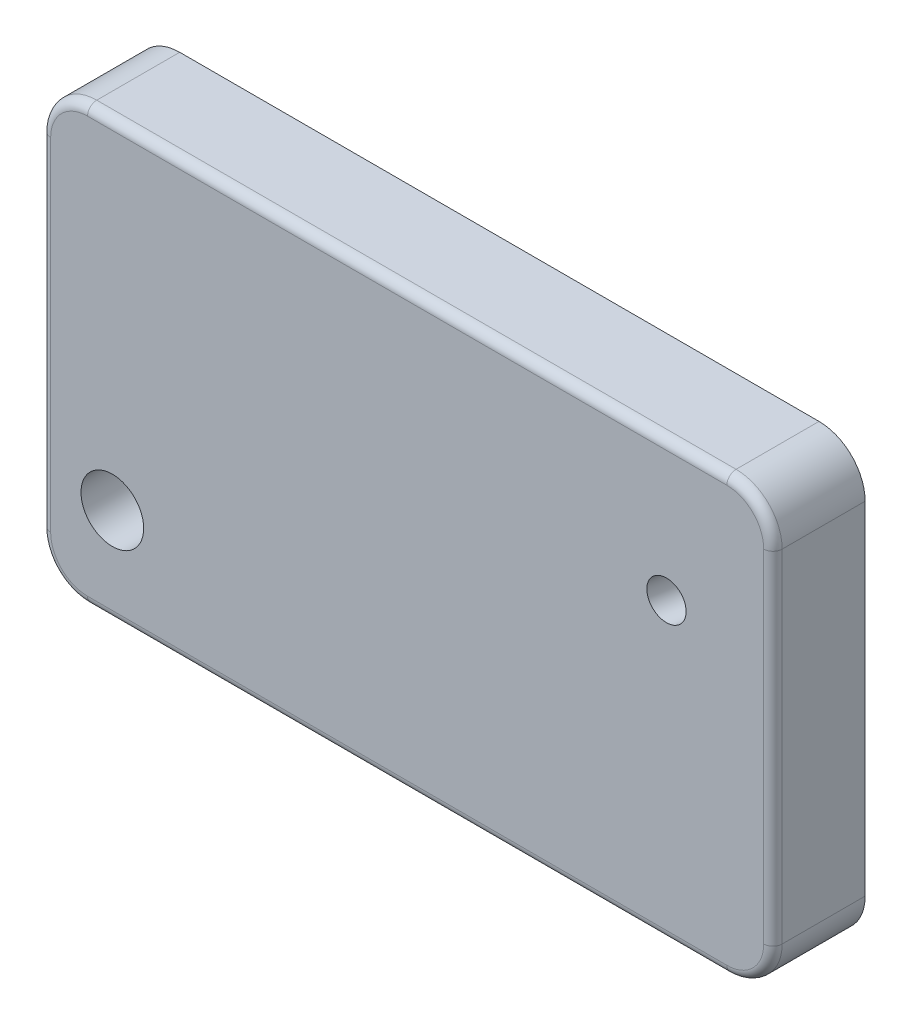
from build123d import *

# Parameters (mm, degrees)
SKETCH1_W           = 43.699940619
SKETCH1_H           = 33.102984907
BOSS_EXTRUDE1_DEPTH = 10
BOSS_EXTRUDE2_DEPTH = 10
M3_TAPPED_HOLE1_D   = 4.2
SKETCH15_W          = 10
SKETCH15_H          = 17.102984907
SKETCH15_W_2        = 13
SKETCH15_H_2        = 47.102984907
CUT_EXTRUDE1_DEPTH  = 10
SKETCH18_W          = 58.662437665
SKETCH18_H          = 17.102984907
BOSS_EXTRUDE4_DEPTH = 10
BOSS_EXTRUDE5_DEPTH = 20
M8_TAPPED_HOLE2_D   = 6.8
FILLET1_R           = 5
FILLET2_R           = 1


with BuildPart() as part:
    # Sketch1 → Boss-Extrude1 (new body)
    with BuildSketch(Plane.XY):
        Polygon((42.979890311, 22.079670103), (-49.382487973, 22.079670103), (-49.382487973, -7.920329897), (-5.682547354, -7.920329897), (42.979890311, -7.920329897), align=None)
        with Locations((-27.532517664, -24.471822351)):
            Rectangle(SKETCH1_W, SKETCH1_H)
    extrude(amount=BOSS_EXTRUDE1_DEPTH)

    # Sketch10 → Boss-Extrude2 (add, symmetric)
    with BuildSketch(Plane(origin=(0, 7.079670103, 0), x_dir=(-1, 0, 0), z_dir=(0, -1, 0))):
        Polygon((-41.673127971, 0), (-24.707127971, 0), (-24.707127971, 2.991563555), align=None)
    extrude(amount=BOSS_EXTRUDE2_DEPTH, both=True)

    # M3 Tapped Hole1 (through all)
    with Locations(Plane(origin=(33.44592172, 6.992687386, -1.450678438), x_dir=(-0.984807753012, 0, -0.173648177667), z_dir=(0.173648177667, 0, -0.984807753012))):
        with Locations((0, 0)):
            Hole(M3_TAPPED_HOLE1_D / 2)

    # Sketch15 → Cut-Extrude1 (cut)
    with BuildSketch(Plane(origin=(0, 0, 0), x_dir=(-1, 0, 0), z_dir=(0, 0, -1))):
        Polygon((5.682547354, -25.023314804), (5.682547354, -41.023314804), (49.382487973, -41.023314804), (49.382487973, -25.023314804), (36.382487973, -25.023314804), (15.682547354, -25.023314804), align=None)
        with Locations((10.682547354, -16.471822351)):
            Rectangle(SKETCH15_W, SKETCH15_H)
        with Locations((42.882487973, -1.471822351)):
            Rectangle(SKETCH15_W_2, SKETCH15_H_2)
    extrude(amount=-CUT_EXTRUDE1_DEPTH, mode=Mode.SUBTRACT)

    # Sketch18 → Boss-Extrude4 (add)
    with BuildSketch(Plane(origin=(0, 0, 0), x_dir=(-1, 0, 0), z_dir=(0, 0, -1))):
        with Locations((-13.648671479, -16.471822351)):
            Rectangle(SKETCH18_W, SKETCH18_H)
    extrude(amount=-BOSS_EXTRUDE4_DEPTH)

    # Sketch19 → Boss-Extrude5 (add)
    with BuildSketch(Plane(origin=(0, 0, 0), x_dir=(-1, 0, 0), z_dir=(0, 0, -1))):
        with BuildLine():
            Line((36.382487973, -25.023314804), (15.730487973, -25.023314804))
            ThreePointArc((15.730487973, -25.023314804), (12.194954067, -23.55884871), (10.730487973, -20.023314804))
            Line((10.730487973, -20.023314804), (10.730487973, -4.371314804))
            ThreePointArc((10.730487973, -4.371314804), (12.194954067, -0.835780898), (15.730487973, 0.628685196))
            Line((15.730487973, 0.628685196), (31.382487973, 0.628685196))
            ThreePointArc((31.382487973, 0.628685196), (34.918021878, -0.835780898), (36.382487973, -4.371314804))
            Line((36.382487973, -4.371314804), (36.382487973, -25.023314804))
        make_face()
    extrude(amount=BOSS_EXTRUDE5_DEPTH)

    # M8 Tapped Hole2 (through all)
    with Locations(Plane(origin=(-28.692487973, -14.610329897, 10), x_dir=(1, 0, 0), z_dir=(0, 0, 1))):
        with Locations((0, 0)):
            Hole(M8_TAPPED_HOLE2_D / 2)

    # Fillet1
    fillet1_edges = [part.edges().sort_by_distance(p)[0] for p in [
        (-36.382487973, -25.023314804, -5),
        (-36.382487973, 22.079670103, 5),
        (42.979890311, -25.023314804, 5),
        (42.979890311, 22.079670103, 5),
    ]]
    fillet(fillet1_edges, radius=FILLET1_R)

    # Fillet2
    fillet2_edges = [part.edges().sort_by_distance(p)[0] for p in [
        (-36.382487973, -1.471822351, 10),
        (3.298701169, 22.079670103, 10),
        (3.298701169, -25.023314804, 10),
        (42.979890311, -1.471822351, 10),
        (-34.918021878, -23.55884871, 10),
        (41.515424217, -23.55884871, 10),
        (41.515424217, 20.615204009, 10),
        (-34.918021878, 20.615204009, 10),
    ]]
    fillet(fillet2_edges, radius=FILLET2_R)


solid = part.part
